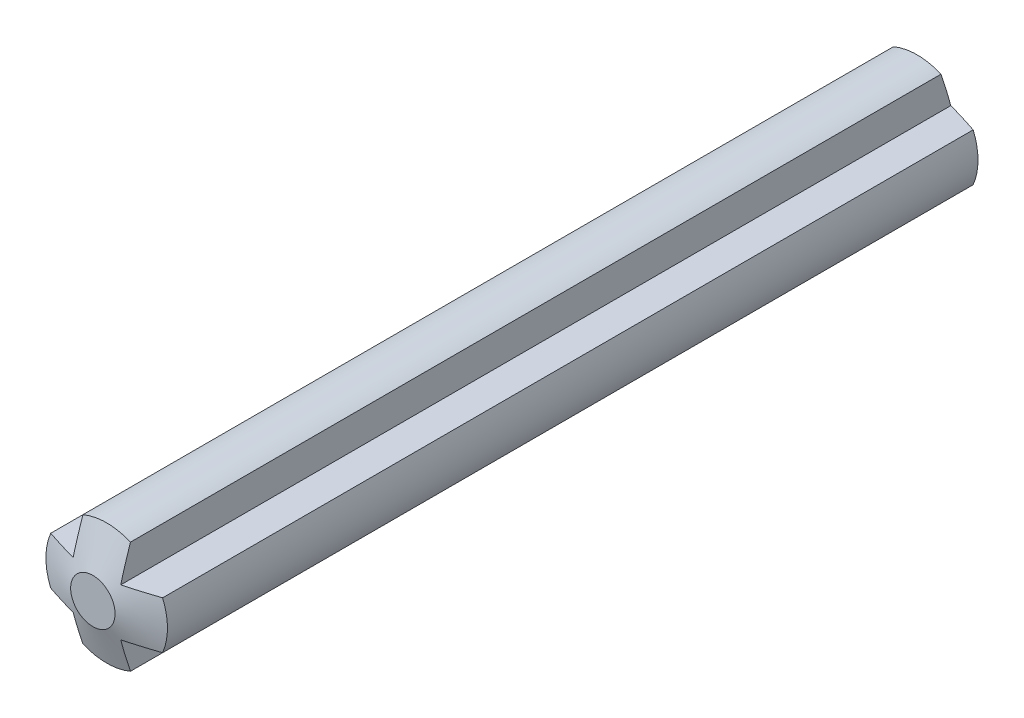
from build123d import *

# Parameters (mm, degrees)
BOSS_EXTRUDE1_DEPTH = 31.72


with BuildPart() as part:
    # Sketch1 → Boss-Extrude1 (new body)
    with BuildSketch(Plane.XY):
        with BuildLine():
            Line((-0.9, 2.116601049), (-0.9, 0.9))
            Line((-0.9, 0.9), (-2.116601049, 0.9))
            ThreePointArc((-2.116601049, 0.9), (-2.3, 0), (-2.116601049, -0.9))
            Line((-2.116601049, -0.9), (-0.9, -0.9))
            Line((-0.9, -0.9), (-0.9, -2.116601049))
            ThreePointArc((-0.9, -2.116601049), (0, -2.3), (0.9, -2.116601049))
            Line((0.9, -2.116601049), (0.9, -0.9))
            Line((0.9, -0.9), (2.116601049, -0.9))
            ThreePointArc((2.116601049, -0.9), (2.3, 0), (2.116601049, 0.9))
            Line((2.116601049, 0.9), (0.9, 0.9))
            Line((0.9, 0.9), (0.9, 2.116601049))
            ThreePointArc((0.9, 2.116601049), (0, 2.3), (-0.9, 2.116601049))
        make_face()
    extrude(amount=BOSS_EXTRUDE1_DEPTH)

    # Sketch2 → Cut-Revolve3 (revolve, cut)
    with BuildSketch(Plane(origin=(0, 0, 0), x_dir=(1, 0, 0), z_dir=(0, 1, 0)), mode=Mode.PRIVATE) as cut_revolve3_sk:
        Polygon((0.228583367, 0.219399408), (2.871914227, 0.219399408), (2.871914227, -0.728161621), align=None)
        Polygon((2.871914227, -30.991838379), (0.228583367, -31.939399408), (2.871914227, -31.939399408), align=None)
    revolve(cut_revolve3_sk.sketch.rotate(Axis((0, 0, -10.126702137), (0, 0, 1)), 156.964321077), axis=Axis((0, 0, -10.126702137), (0, 0, 1)), mode=Mode.SUBTRACT)


solid = part.part
